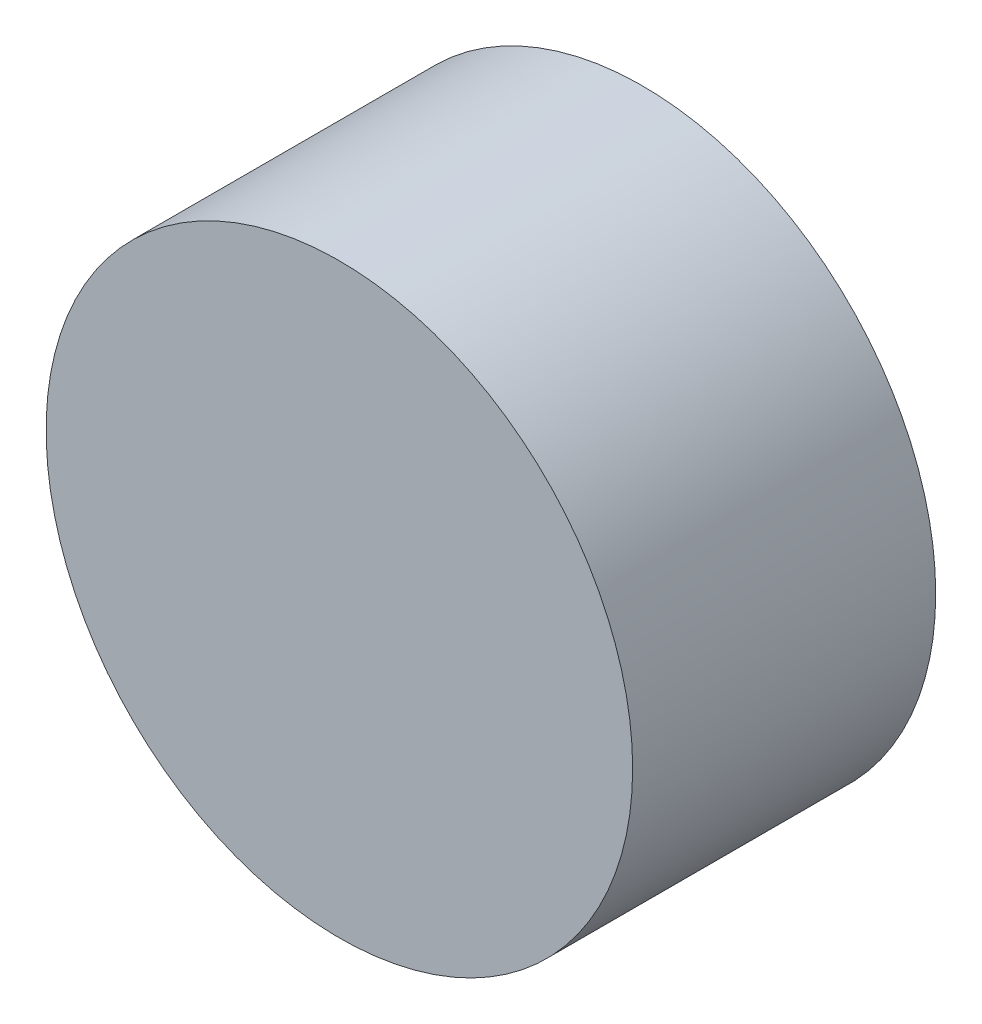
from build123d import *

# Parameters (mm, degrees)
SKETCH1_R           = 30
BOSS_EXTRUDE1_DEPTH = 31


with BuildPart() as part:
    # Sketch1 → Boss-Extrude1 (new body)
    with BuildSketch(Plane.XY):
        with Locations((-15.821814743, 16.003674683)):
            Circle(SKETCH1_R)
    extrude(amount=BOSS_EXTRUDE1_DEPTH)


solid = part.part
